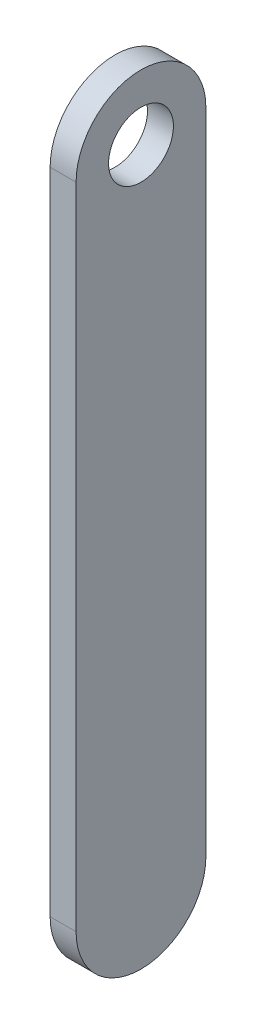
from build123d import *

# Parameters (mm, degrees)
BOSS_EXTRUDE1_DEPTH      = 4
BOSS_EXTRUDE1_DEPTH_BACK = 4
SKETCH2_R                = 20
SKETCH2_R_2              = 10


with BuildPart() as part:
    # Sketch2 → Boss-Extrude1 (new, two sides: drawn at the far end of the back side and taken through both)
    # profile 1 of 3: a face of its own
    with BuildSketch(Plane(origin=(0, 0, 0), x_dir=(0, 0, -1), z_dir=(1, 0, 0)).offset(-BOSS_EXTRUDE1_DEPTH_BACK)):
        with BuildLine():
            ThreePointArc((20, 0), (0, -20), (-20, 0))
            Line((-20, 0), (-20, -200))
            ThreePointArc((-20, -200), (0, -180), (20, -200))
            Line((20, -200), (20, 0))
        make_face()
    # profile 2 of 3: a face of its own
    with BuildSketch(Plane(origin=(0, 0, 0), x_dir=(0, 0, -1), z_dir=(1, 0, 0)).offset(-BOSS_EXTRUDE1_DEPTH_BACK)):
        Circle(SKETCH2_R)
        Circle(SKETCH2_R_2, mode=Mode.SUBTRACT)
    # profile 3 of 3: a face of its own
    with BuildSketch(Plane(origin=(0, 0, 0), x_dir=(0, 0, -1), z_dir=(1, 0, 0)).offset(-BOSS_EXTRUDE1_DEPTH_BACK)):
        with Locations((0, -200)):
            Circle(SKETCH2_R)
    extrude(amount=BOSS_EXTRUDE1_DEPTH + BOSS_EXTRUDE1_DEPTH_BACK)


solid = part.part
